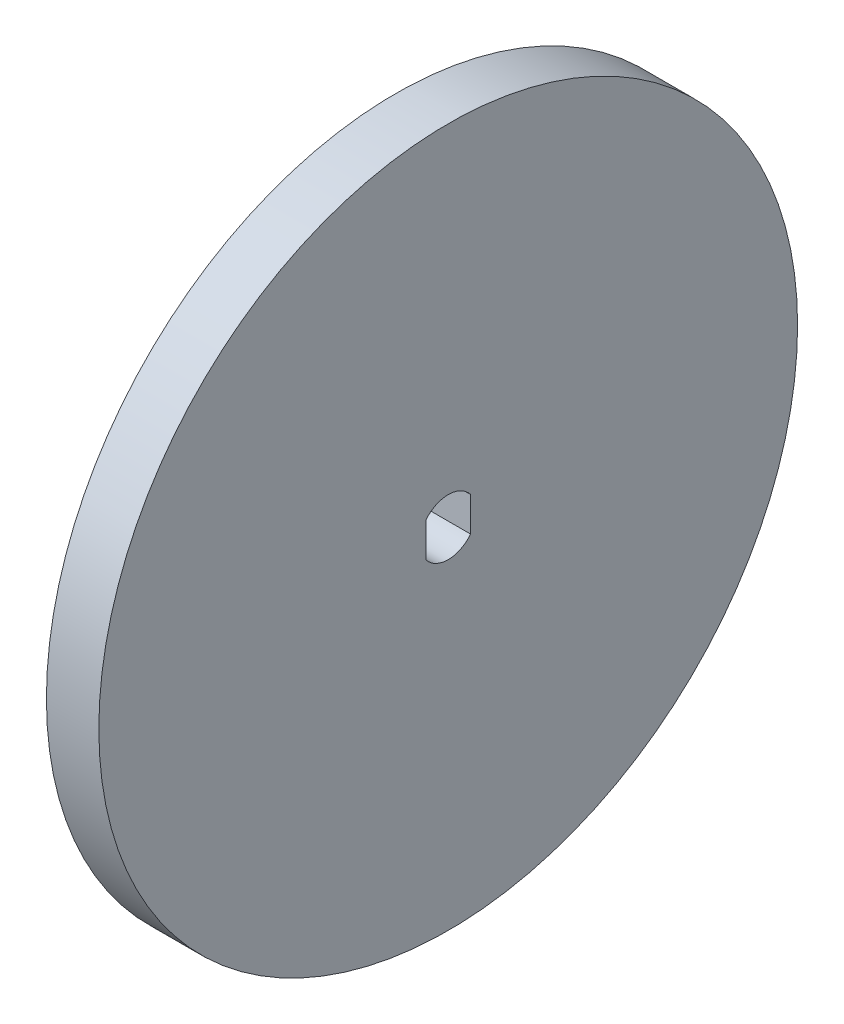
from build123d import *

# Parameters (mm, degrees)
SKETCH1_R  = 18
BASE_DEPTH = 2.7


with BuildPart() as part:
    # Sketch1 → Base (new body)
    with BuildSketch(Plane(origin=(0, 0, 0), x_dir=(0, 0, -1), z_dir=(1, 0, 0))):
        with Locations(Location((0, 0, 0), (0, 0, 180))):
            Circle(SKETCH1_R)
        with BuildLine():
            Line((1.15, 0.883176087), (1.15, -0.883176087))
            ThreePointArc((1.15, -0.883176087), (0, -1.45), (-1.15, -0.883176087))
            Line((-1.15, -0.883176087), (-1.15, 0.883176087))
            ThreePointArc((-1.15, 0.883176087), (0, 1.45), (1.15, 0.883176087))
        make_face(mode=Mode.SUBTRACT)
    extrude(amount=BASE_DEPTH)


solid = part.part
